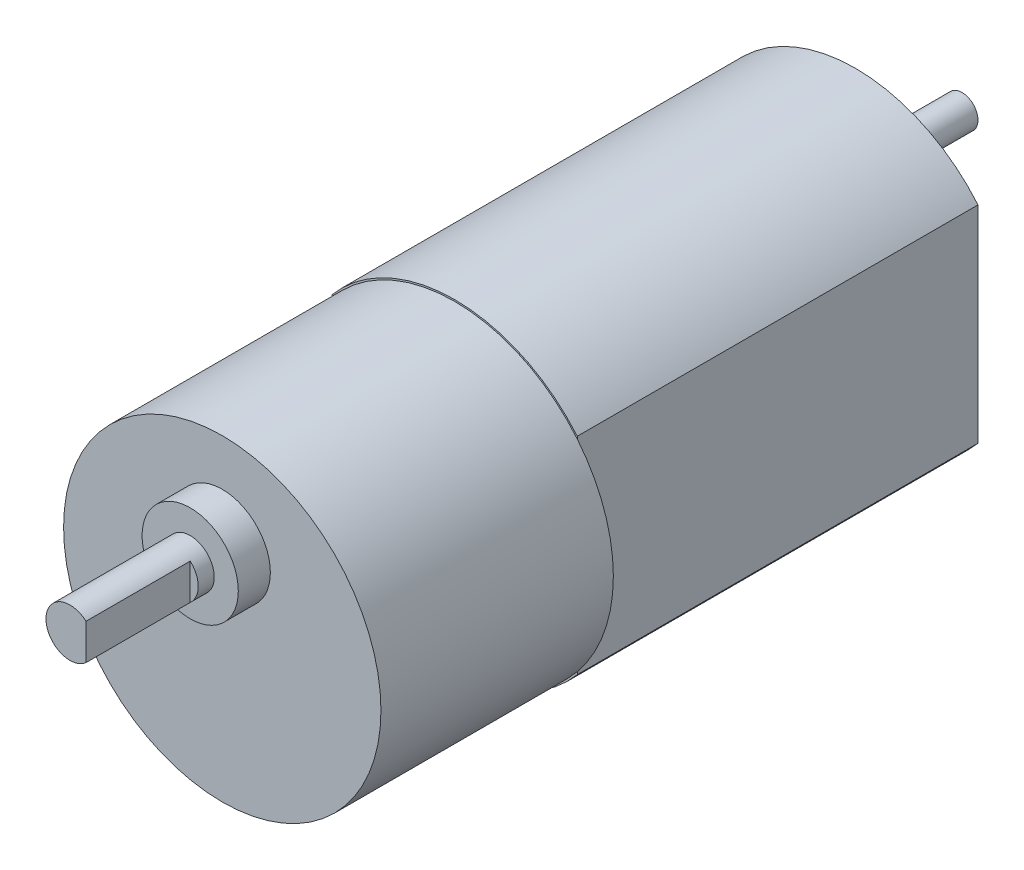
from build123d import *

# Parameters (mm, degrees)
EXTRUDE1_DEPTH = 25
SKETCH2_R      = 9.9
EXTRUDE2_DEPTH = 14.5
SKETCH3_R      = 3
EXTRUDE3_DEPTH = 2.5
SKETCH4_R      = 1
EXTRUDE4_DEPTH = 3
SKETCH5_R      = 1
EXTRUDE5_DEPTH = 4
SKETCH6_R      = 3
EXTRUDE6_DEPTH = 2
SKETCH7_R      = 1.5
EXTRUDE7_DEPTH = 7.5
SKETCH8_W      = 0.5
SKETCH8_H      = 2.236067978
EXTRUDE8_DEPTH = 6.5


with BuildPart() as part:
    # Sketch1 → Extrude1 (new body)
    with BuildSketch(Plane.XY):
        with BuildLine():
            Line((-7.65, 6.440302788), (-7.65, -6.440302788))
            ThreePointArc((-7.65, -6.440302788), (0, -10), (7.65, -6.440302788))
            Line((7.65, -6.440302788), (7.65, 6.440302788))
            ThreePointArc((7.65, 6.440302788), (0, 10), (-7.65, 6.440302788))
        make_face()
    extrude(amount=EXTRUDE1_DEPTH)

    # Sketch2 → Extrude2 (add)
    with BuildSketch(Plane.XY.offset(25)):
        with Locations(Location((0, 0, 0), (0, 0, 140.599431246))):
            Circle(SKETCH2_R)
    extrude(amount=EXTRUDE2_DEPTH)

    # Sketch3 → Extrude3 (add)
    with BuildSketch(Plane(origin=(0, 0, 0), x_dir=(-1, 0, 0), z_dir=(0, 0, -1))):
        with Locations(Location((0, 0, 0), (0, 0, 180))):
            Circle(SKETCH3_R)
    extrude(amount=EXTRUDE3_DEPTH)

    # Sketch4 → Extrude4 (add)
    with BuildSketch(Plane(origin=(0, 0, -2.5), x_dir=(-1, 0, 0), z_dir=(0, 0, -1))):
        Circle(SKETCH4_R)
    extrude(amount=EXTRUDE4_DEPTH)

    # Sketch5 → Extrude5 (add)
    with BuildSketch(Plane(origin=(0, 0, 0), x_dir=(-1, 0, 0), z_dir=(0, 0, -1))):
        with Locations(Location((-2.65, 7.016231182, 0), (0, 0, 180))):
            Circle(SKETCH5_R)
        with Locations(Location((2.65, -7.016231182, 0), (0, 0, 180))):
            Circle(SKETCH5_R)
    extrude(amount=EXTRUDE5_DEPTH)

    # Sketch6 → Extrude6 (add)
    with BuildSketch(Plane.XY.offset(39.5)):
        with Locations((0, 4)):
            Circle(SKETCH6_R)
    extrude(amount=EXTRUDE6_DEPTH)

    # Sketch7 → Extrude7 (add)
    with BuildSketch(Plane.XY.offset(41.5)):
        with Locations((0, 4)):
            Circle(SKETCH7_R)
    extrude(amount=EXTRUDE7_DEPTH)

    # Sketch8 → Extrude8 (cut)
    with BuildSketch(Plane.XY.offset(49)):
        with Locations((1.25, 4)):
            Rectangle(SKETCH8_W, SKETCH8_H)
    extrude(amount=-EXTRUDE8_DEPTH, mode=Mode.SUBTRACT)


solid = part.part
